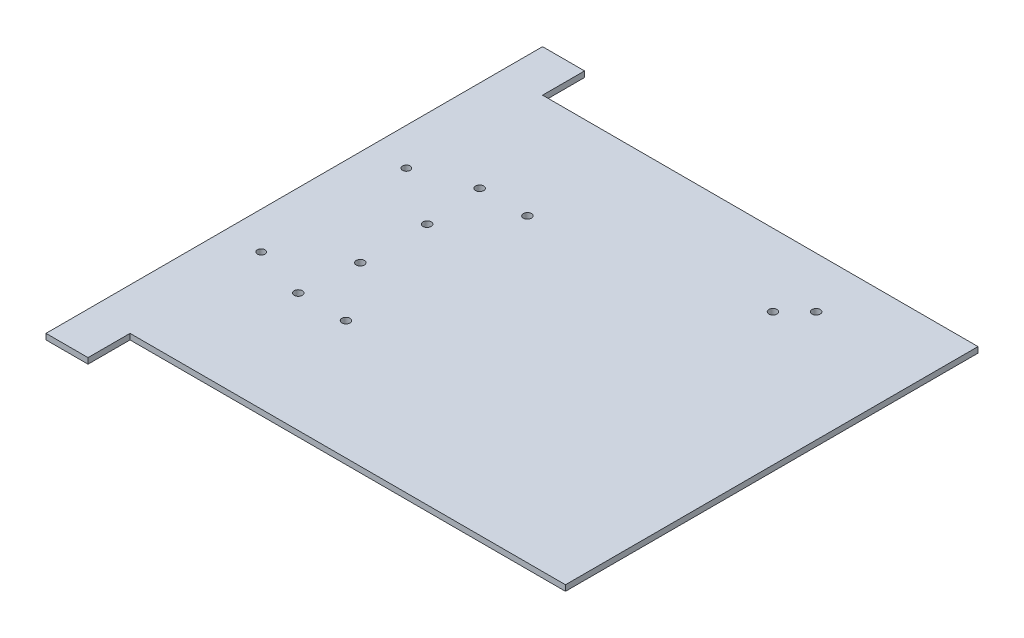
from build123d import *

# Parameters (mm, degrees)
BOSS_EXTRUDE1_DEPTH = 3
SKETCH2_R           = 2.125
CUT_EXTRUDE1_DEPTH  = 3
SKETCH3_R           = 2
CUT_EXTRUDE2_DEPTH  = 3
SKETCH4_R           = 2.125
CUT_EXTRUDE3_DEPTH  = 3
SKETCH5_W           = 470
SKETCH5_H           = 260
CUT_EXTRUDE4_DEPTH  = 3


with BuildPart() as part:
    # Sketch1 → Boss-Extrude1 (new body)
    with BuildSketch(Plane(origin=(0, 0, 0), x_dir=(1, 0, 0), z_dir=(0, 1, 0))):
        Polygon((-360, -130), (-360, 130), (-338, 130), (-338, 108), (338, 108), (338, 130), (360, 130), (360, -130), (338, -130), (338, -108), (-338, -108), (-338, -130), align=None)
    extrude(amount=BOSS_EXTRUDE1_DEPTH)

    # Sketch2 → Cut-Extrude1 (cut)
    with BuildSketch(Plane(origin=(0, 3, 0), x_dir=(1, 0, 0), z_dir=(0, 1, 0))):
        with Locations(Location((307.763857235, 49.302866975, 0), (0, 0, 270))):
            Circle(SKETCH2_R)
        with Locations(Location((282.763857235, 49.302866975, 0), (0, 0, 270))):
            Circle(SKETCH2_R)
        with Locations(Location((305.263857235, 19.302866975, 0), (0, 0, 270))):
            Circle(SKETCH2_R)
        with Locations(Location((305.263857235, -15.697133025, 0), (0, 0, 270))):
            Circle(SKETCH2_R)
        with Locations(Location((307.763857235, -45.697133025, 0), (0, 0, 270))):
            Circle(SKETCH2_R)
        with Locations(Location((282.763857235, -45.697133025, 0), (0, 0, 270))):
            Circle(SKETCH2_R)
        with Locations(Location((-287.236142765, -45.697133025, 0), (0, 0, 90))):
            Circle(SKETCH2_R)
        with Locations(Location((-312.236142765, -45.697133025, 0), (0, 0, 90))):
            Circle(SKETCH2_R)
        with Locations(Location((-309.736142765, -15.697133025, 0), (0, 0, 90))):
            Circle(SKETCH2_R)
        with Locations(Location((-309.736142765, 19.302866975, 0), (0, 0, 90))):
            Circle(SKETCH2_R)
        with Locations(Location((-287.236142765, 49.302866975, 0), (0, 0, 90))):
            Circle(SKETCH2_R)
        with Locations(Location((-312.236142765, 49.302866975, 0), (0, 0, 90))):
            Circle(SKETCH2_R)
    extrude(amount=-CUT_EXTRUDE1_DEPTH, mode=Mode.SUBTRACT)

    # Sketch3 → Cut-Extrude2 (cut)
    with BuildSketch(Plane(origin=(0, 3, 0), x_dir=(1, 0, 0), z_dir=(0, 1, 0))):
        with Locations(Location((339.440964309, 39.243831284, 0), (0, 0, 270))):
            Circle(SKETCH3_R)
        with Locations(Location((339.440964309, -36.756168716, 0), (0, 0, 90))):
            Circle(SKETCH3_R)
        with Locations(Location((-340.559035691, -36.756168716, 0), (0, 0, 270))):
            Circle(SKETCH3_R)
        with Locations(Location((-340.559035691, 39.243831284, 0), (0, 0, 90))):
            Circle(SKETCH3_R)
    extrude(amount=-CUT_EXTRUDE2_DEPTH, mode=Mode.SUBTRACT)

    # Sketch4 → Cut-Extrude3 (cut)
    with BuildSketch(Plane(origin=(0, 3, 0), x_dir=(1, 0, 0), z_dir=(0, 1, 0))):
        with Locations((66.609635331, -175.983550473)):
            Circle(SKETCH4_R)
        with Locations(Location((-179.463524521, 70.08960938, 0), (0, 0, 270))):
            Circle(SKETCH4_R)
        with Locations(Location((-15.414751286, -93.959163855, 0), (0, 0, 270))):
            Circle(SKETCH4_R)
        with Locations(Location((-97.439137904, -11.934777238, 0), (0, 0, 270))):
            Circle(SKETCH4_R)
        with Locations((77.92334383, -164.669841974)):
            Circle(SKETCH4_R)
        with Locations(Location((-4.101042787, -82.645455356, 0), (0, 0, 90))):
            Circle(SKETCH4_R)
        with Locations(Location((-86.125429405, -0.621068739, 0), (0, 0, 90))):
            Circle(SKETCH4_R)
        with Locations(Location((-168.149816022, 81.403317879, 0), (0, 0, 90))):
            Circle(SKETCH4_R)
        with Locations((-49.355876783, 200.197257118)):
            Circle(SKETCH4_R)
        with Locations((32.668509835, 118.172870501)):
            Circle(SKETCH4_R)
        with Locations(Location((114.692896452, 36.148483883, 0), (0, 0, 270))):
            Circle(SKETCH4_R)
        with Locations(Location((196.71728307, -45.875902734, 0), (0, 0, 270))):
            Circle(SKETCH4_R)
        with Locations((43.982218334, 129.486579)):
            Circle(SKETCH4_R)
        with Locations(Location((126.006604951, 47.462192382, 0), (0, 0, 90))):
            Circle(SKETCH4_R)
        with Locations((-38.042168284, 211.510965617)):
            Circle(SKETCH4_R)
        with Locations(Location((208.030991569, -34.562194235, 0), (0, 0, 90))):
            Circle(SKETCH4_R)
    extrude(amount=-CUT_EXTRUDE3_DEPTH, mode=Mode.SUBTRACT)

    # Sketch5 → Cut-Extrude4 (cut)
    with BuildSketch(Plane(origin=(0, 3, 0), x_dir=(1, 0, 0), z_dir=(0, 1, 0))):
        with Locations((125, 0)):
            Rectangle(SKETCH5_W, SKETCH5_H)
    extrude(amount=-CUT_EXTRUDE4_DEPTH, mode=Mode.SUBTRACT)


solid = part.part
